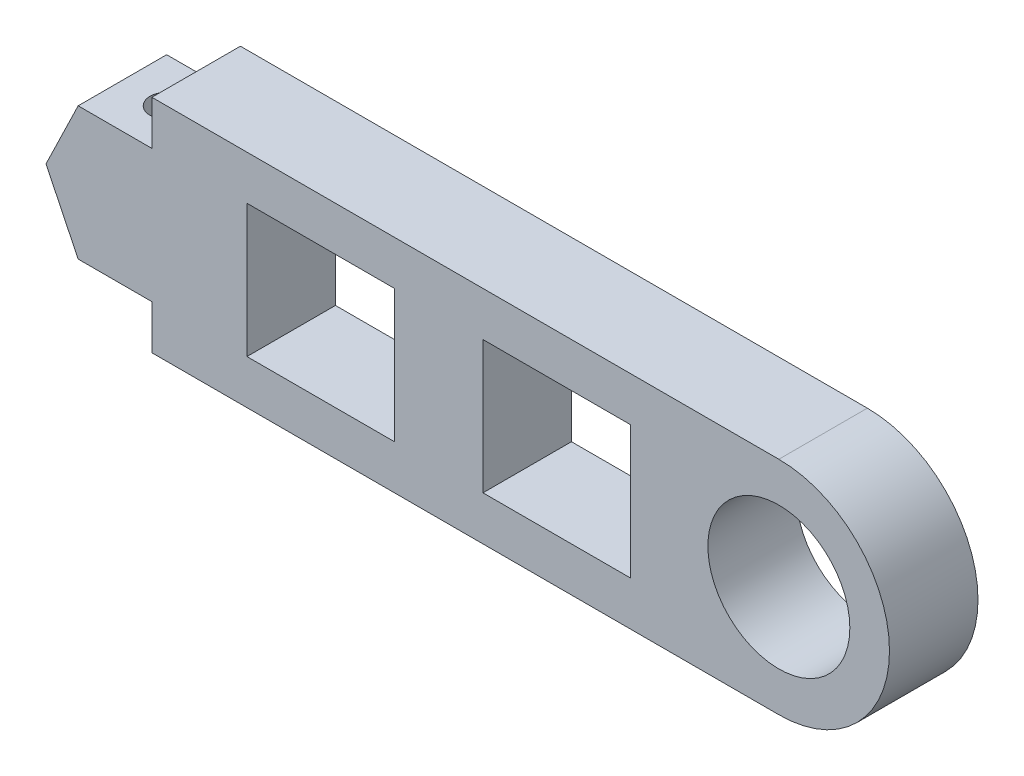
from build123d import *

# Parameters (mm, degrees)
SKETCH1_R           = 9.625
SKETCH1_W           = 20
SKETCH1_H           = 18
BOSS_EXTRUDE1_DEPTH = 12
SKETCH2_R           = 2.25
CUT_EXTRUDE1_DEPTH  = 104.537432844


with BuildPart() as part:
    # Sketch1 → Boss-Extrude1 (new body)
    with BuildSketch(Plane.XY):
        with BuildLine():
            Line((0, 15), (85, 15))
            ThreePointArc((85, 15), (100, 0), (85, -15))
            Line((85, -15), (0, -15))
            Line((0, -15), (0, -9))
            Line((0, -9), (-10, -9))
            Line((-10, -9), (-14.358898944, 0))
            Line((-14.358898944, 0), (-10, 9))
            Line((-10, 9), (0, 9))
            Line((0, 9), (0, 15))
        make_face()
        with Locations((85, 0)):
            Circle(SKETCH1_R, mode=Mode.SUBTRACT)
        with Locations((22.884427269, 0)):
            Rectangle(SKETCH1_W, SKETCH1_H, mode=Mode.SUBTRACT)
        with Locations((54.884427269, 0)):
            Rectangle(SKETCH1_W, SKETCH1_H, mode=Mode.SUBTRACT)
    extrude(amount=BOSS_EXTRUDE1_DEPTH)

    # Sketch2 → Cut-Extrude1 (cut, through all)
    with BuildSketch(Plane.XZ.offset(9)):
        with Locations((-4, 6)):
            Circle(SKETCH2_R)
    extrude(amount=-CUT_EXTRUDE1_DEPTH, mode=Mode.SUBTRACT)


solid = part.part
